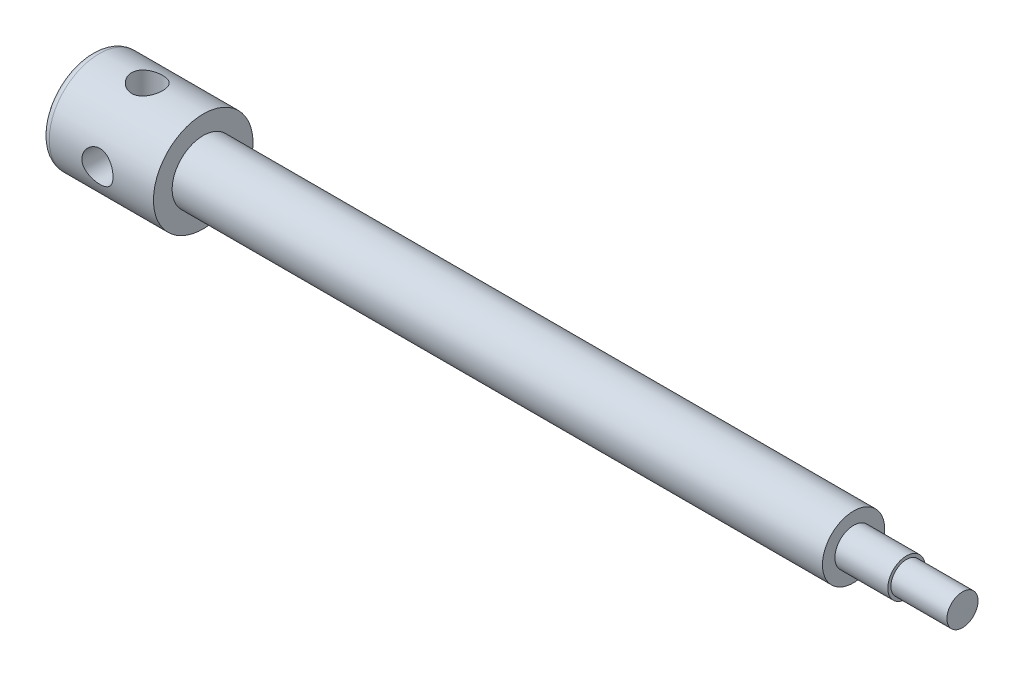
from build123d import *

# Parameters (mm, degrees)
SKETCH3_R      = 5
EXTRUDE2_DEPTH = 20
SKETCH2_R      = 5
EXTRUDE3_DEPTH = 20


with BuildPart() as part:
    # Sketch1 → Revolve1 (revolve)
    with BuildSketch(Plane.XY, mode=Mode.PRIVATE) as revolve1_sk:
        with BuildLine():
            Line((-89.926247849, 0), (-89.926247849, 13.5))
            ThreePointArc((-89.926247849, 13.5), (-89.194014801, 15.267766953), (-87.426247849, 16))
            Line((-87.426247849, 16), (-53.926247849, 16))
            Line((-53.926247849, 16), (-53.926247849, 10))
            Line((-53.926247849, 10), (155.073752151, 10))
            Line((155.073752151, 10), (155.073752151, 6))
            Line((155.073752151, 6), (172.073752151, 6))
            Line((172.073752151, 6), (172.073752151, 5))
            Line((172.073752151, 5), (190.073752151, 5))
            Line((190.073752151, 5), (190.073752151, 0))
            Line((190.073752151, 0), (-89.926247849, 0))
        make_face()
    revolve(revolve1_sk.sketch.rotate(Axis((0, 0, 0), (1, 0, 0)), 90), axis=Axis((0, 0, 0), (1, 0, 0)))

    # Sketch3 → Extrude2 (cut, symmetric)
    with BuildSketch(Plane.XY):
        with Locations((-71.926247849, 0)):
            Circle(SKETCH3_R)
    extrude(amount=EXTRUDE2_DEPTH, both=True, mode=Mode.SUBTRACT)

    # Sketch2 → Extrude3 (cut, symmetric)
    with BuildSketch(Plane(origin=(0, 0, 0), x_dir=(1, 0, 0), z_dir=(0, 1, 0))):
        with Locations(Location((-71.926247849, 0, 0), (0, 0, 270))):
            Circle(SKETCH2_R)
    extrude(amount=EXTRUDE3_DEPTH, both=True, mode=Mode.SUBTRACT)


solid = part.part
